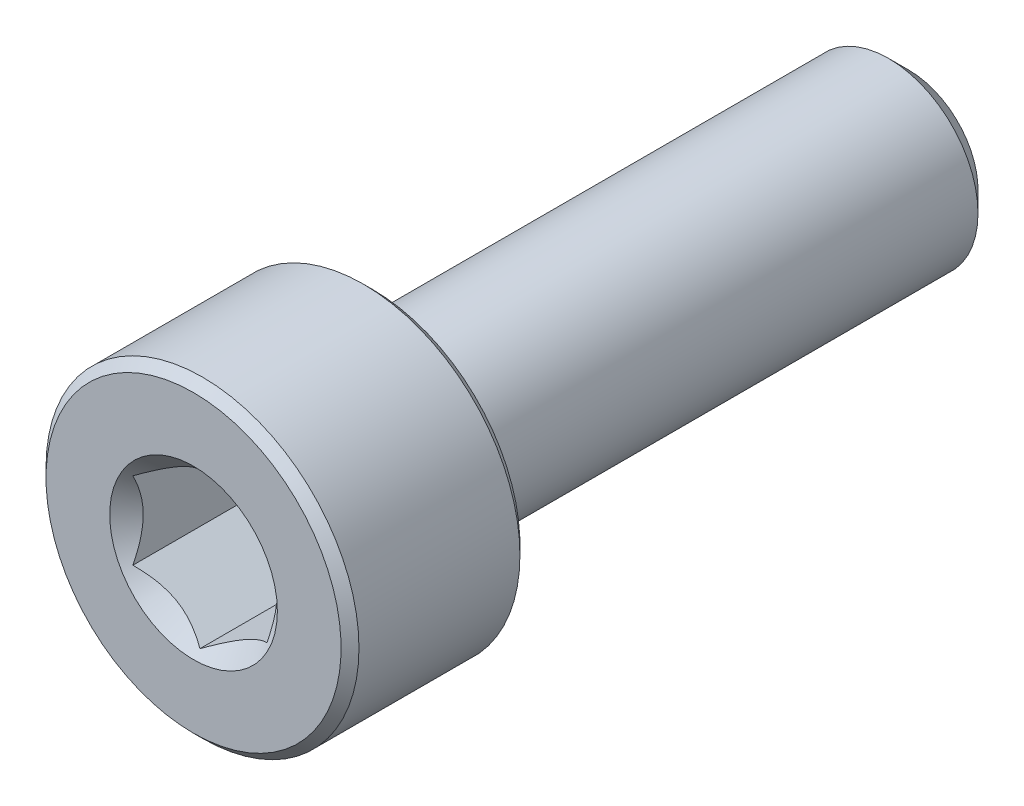
from build123d import *

# Parameters (mm, degrees)
CUT_EXTRUDE1_DEPTH = 3


with BuildPart() as part:
    # Sketch2 → Revolve1 (revolve)
    with BuildSketch(Plane(origin=(0, 0, 0), x_dir=(0, 0, -1), z_dir=(1, 0, 0))):
        with BuildLine():
            Line((-8, 0), (-8, 3.3))
            Line((-8, 3.3), (-7.8, 3.5))
            Line((-7.8, 3.5), (-4.2, 3.5))
            Line((-4.2, 3.5), (-4, 3.3))
            Line((-4, 3.3), (-4, 2.2))
            ThreePointArc((-4, 2.2), (-3.941421356, 2.058578644), (-3.8, 2))
            Line((-3.8, 2), (7.545336663, 2))
            Line((7.545336663, 2), (8, 1.545336663))
            Line((8, 1.545336663), (8, 0))
            Line((8, 0), (-8, 0))
        make_face()
    revolve(axis=Axis((0, 0, -8), (0, 0, 1)))

    # Sketch3 → Cut-Extrude1 (cut)
    with BuildSketch(Plane.XY.offset(8)):
        Polygon((1.5, -0.866025404), (1.5, 0.866025404), (0, 1.732050808), (-1.5, 0.866025404), (-1.5, -0.866025404), (0, -1.732050808), align=None)
    extrude(amount=-CUT_EXTRUDE1_DEPTH, mode=Mode.SUBTRACT)

    # Cut-Extrude2 cone 1 section (through the dimple's axis) → Cut-Extrude2 (revolve, cut)
    with BuildSketch(Plane(origin=(0, 0, 8), x_dir=(0, -1, 0), z_dir=(1, 0, 0))):
        Polygon((0, 0), (1.875, 0), (0, 1.875), align=None)
    revolve(axis=Axis((0, 0, 8), (0, 0, -1)), mode=Mode.SUBTRACT)


solid = part.part
